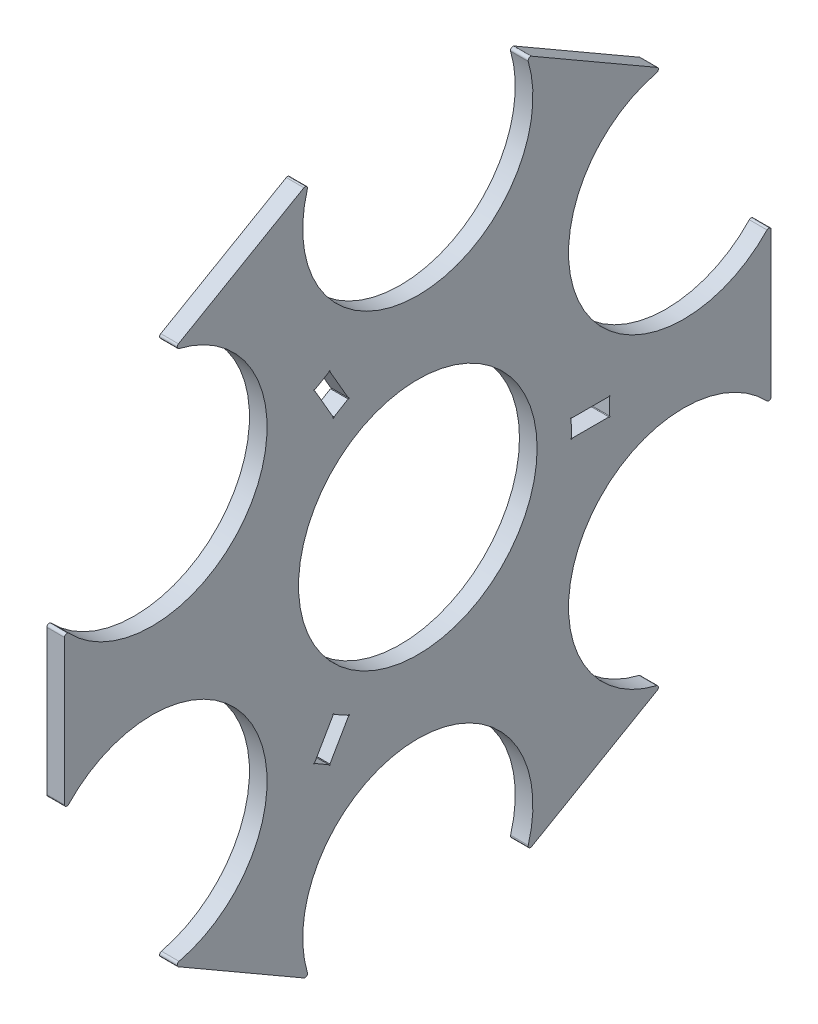
from build123d import *

# Parameters (mm, degrees)
SKETCH2_R           = 39.487475
BOSS_EXTRUDE1_DEPTH = 5.842
FILLET1_R           = 0.79375
CUT_EXTRUDE2_DEPTH  = 163.986308211
CIRPATTERN2_COUNT   = 3


with BuildPart() as part:
    # Sketch2 → Boss-Extrude1 (new body)
    with BuildSketch(Plane(origin=(0, 0, 0), x_dir=(0, 0, -1), z_dir=(1, 0, 0))):
        with BuildLine():
            Line((81.02619141, 88.258519733), (35.921024484, 114.3))
            ThreePointArc((35.921024484, 114.3), (0, 63.5), (-35.921024484, 114.3))
            Line((-35.921024484, 114.3), (-81.02619141, 88.258519733))
            ThreePointArc((-81.02619141, 88.258519733), (-54.99261314, 31.75), (-116.947215895, 26.041480267))
            Line((-116.947215895, 26.041480267), (-116.947215895, -26.041480267))
            ThreePointArc((-116.947215895, -26.041480267), (-54.99261314, -31.75), (-81.02619141, -88.258519733))
            Line((-81.02619141, -88.258519733), (-35.921024484, -114.3))
            ThreePointArc((-35.921024484, -114.3), (0, -63.5), (35.921024484, -114.3))
            Line((35.921024484, -114.3), (81.02619141, -88.258519733))
            ThreePointArc((81.02619141, -88.258519733), (54.99261314, -31.75), (116.947215895, -26.041480267))
            Line((116.947215895, -26.041480267), (116.947215895, 26.041480267))
            ThreePointArc((116.947215895, 26.041480267), (54.99261314, 31.75), (81.02619141, 88.258519733))
        make_face()
        Circle(SKETCH2_R, mode=Mode.SUBTRACT)
    extrude(amount=BOSS_EXTRUDE1_DEPTH)

    # Fillet1
    fillet1_edges = [part.edges().sort_by_distance(p)[0] for p in [
        (2.921, 88.258519733, 81.02619141),
        (2.921, 114.3, 35.921024484),
        (2.921, 114.3, -35.921024484),
        (2.921, 88.258519733, -81.02619141),
        (2.921, 26.041480267, -116.947215895),
        (2.921, -26.041480267, -116.947215895),
        (2.921, -88.258519733, -81.02619141),
        (2.921, -114.3, -35.921024484),
        (2.921, -114.3, 35.921024484),
        (2.921, -88.258519733, 81.02619141),
        (2.921, -26.041480267, 116.947215895),
        (2.921, 26.041480267, 116.947215895),
    ]]
    fillet(fillet1_edges, radius=FILLET1_R)

    # Sketch6 → Cut-Extrude2 (cut, through all)
    with BuildSketch(Plane(origin=(5.842, 0, 0), x_dir=(0, 0, -1), z_dir=(1, 0, 0))):
        with BuildLine():
            Line((-23.004455913, 45.686886441), (-29.096698147, 56.238959523))
            ThreePointArc((-29.096698147, 56.238959523), (-29.144557493, 56.602487346), (-29.367768813, 56.311592689))
            Line((-29.367768813, 56.311592689), (-34.08338539, 53.589030189))
            ThreePointArc((-34.08338539, 53.589030189), (-34.446913212, 53.541170844), (-34.156018556, 53.317959523))
            Line((-34.156018556, 53.317959523), (-28.004456056, 42.663140727))
            ThreePointArc((-28.004456056, 42.663140727), (-27.954648068, 42.299101356), (-27.735435356, 42.593976392))
            Line((-27.735435356, 42.593976392), (-23.075039112, 45.412346944))
            ThreePointArc((-23.075039112, 45.412346944), (-22.713049707, 45.465623764), (-23.004455913, 45.686886441))
        make_face()
    cut_extrude2 = extrude(amount=-CUT_EXTRUDE2_DEPTH, mode=Mode.SUBTRACT)

    # CirPattern2: Cut-Extrude2 ×3 about axis
    cirpattern2_axis = Axis((0, 0, 0), (1, 0, 0))
    for i in range(1, CIRPATTERN2_COUNT):
        add(cut_extrude2.rotate(cirpattern2_axis, i * 360 / CIRPATTERN2_COUNT), mode=Mode.SUBTRACT)


solid = part.part
